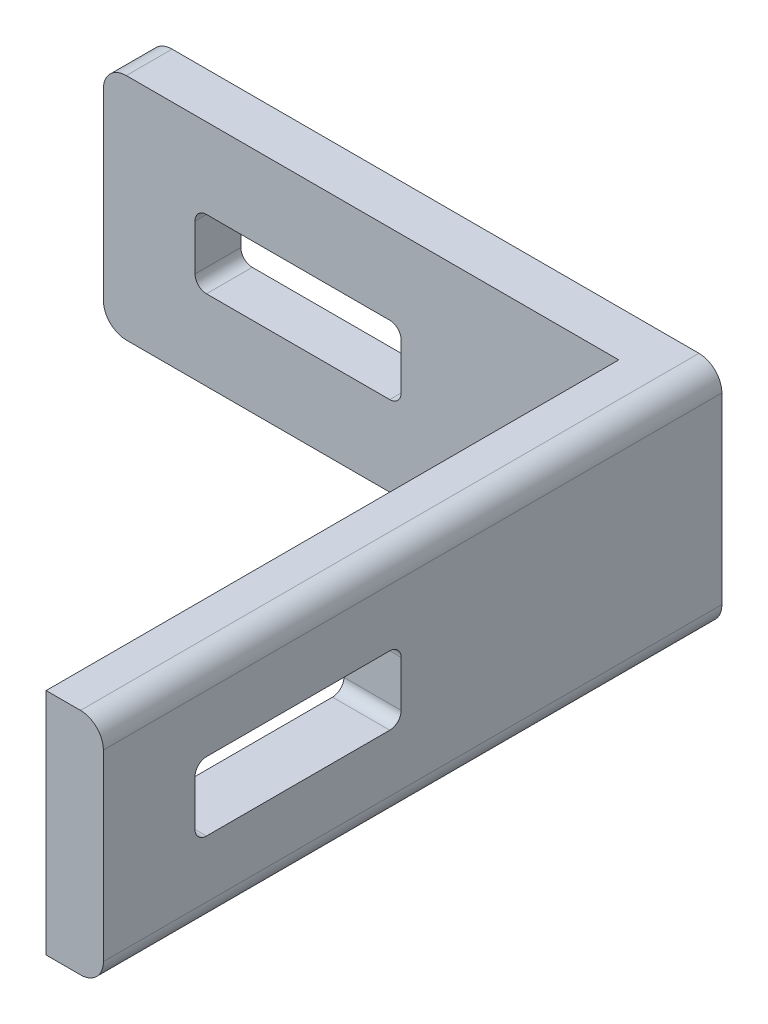
from build123d import *

# Parameters (mm, degrees)
BOSS_EXTRU_1_DEPTH      = 4
BOSS_EXTRU_3_DEPTH      = 50
ENL_V_MAT_EXTRU_1_DEPTH = 50
ENL_V_MAT_EXTRU_2_DEPTH = 50


with BuildPart() as part:
    # Esquisse1 → Boss.-Extru.1 (new body)
    with BuildSketch(Plane.XY):
        with BuildLine():
            Line((-11.273273273, 8.708708709), (34.726726727, 8.708708709))
            ThreePointArc((34.726726727, 8.708708709), (36.140940289, 8.122922271), (36.726726727, 6.708708709))
            Line((36.726726727, 6.708708709), (36.726726727, -9.291291291))
            ThreePointArc((36.726726727, -9.291291291), (36.140940289, -10.705504854), (34.726726727, -11.291291291))
            Line((34.726726727, -11.291291291), (-11.273273273, -11.291291291))
            ThreePointArc((-11.273273273, -11.291291291), (-12.687486836, -10.705504854), (-13.273273273, -9.291291291))
            Line((-13.273273273, -9.291291291), (-13.273273273, 6.708708709))
            ThreePointArc((-13.273273273, 6.708708709), (-12.687486836, 8.122922271), (-11.273273273, 8.708708709))
        make_face()
    extrude(amount=BOSS_EXTRU_1_DEPTH)

    # Esquisse2 → Boss.-Extru.3 (add)
    with BuildSketch(Plane.XY.offset(4)):
        with BuildLine():
            Line((31.726726727, 8.708708709), (34.726726727, 8.708708709))
            ThreePointArc((34.726726727, 8.708708709), (36.140940289, 8.122922271), (36.726726727, 6.708708709))
            Line((36.726726727, 6.708708709), (36.726726727, -9.291291291))
            ThreePointArc((36.726726727, -9.291291291), (36.140940289, -10.705504854), (34.726726727, -11.291291291))
            Line((34.726726727, -11.291291291), (31.726726727, -11.291291291))
            Line((31.726726727, -11.291291291), (31.726726727, 8.708708709))
        make_face()
    extrude(amount=BOSS_EXTRU_3_DEPTH)

    # Esquisse3 → Enlèv. mat.-Extru.1 (cut)
    with BuildSketch(Plane.XY.offset(4)):
        with BuildLine():
            Line((-4.273273273, 1.708708709), (11.726726727, 1.708708709))
            ThreePointArc((11.726726727, 1.708708709), (12.433833508, 1.41581549), (12.726726727, 0.708708709))
            Line((12.726726727, 0.708708709), (12.726726727, -3.291291291))
            ThreePointArc((12.726726727, -3.291291291), (12.433833508, -3.998398072), (11.726726727, -4.291291291))
            Line((11.726726727, -4.291291291), (-4.273273273, -4.291291291))
            ThreePointArc((-4.273273273, -4.291291291), (-4.980380054, -3.998398072), (-5.273273273, -3.291291291))
            Line((-5.273273273, -3.291291291), (-5.273273273, 0.708708709))
            ThreePointArc((-5.273273273, 0.708708709), (-4.980380054, 1.41581549), (-4.273273273, 1.708708709))
        make_face()
    extrude(amount=-ENL_V_MAT_EXTRU_1_DEPTH, mode=Mode.SUBTRACT)

    # Esquisse4 → Enlèv. mat.-Extru.2 (cut)
    with BuildSketch(Plane.ZY.offset(-31.726726727)):
        with BuildLine():
            Line((29, 1.708708709), (45, 1.708708709))
            ThreePointArc((45, 1.708708709), (45.707106781, 1.41581549), (46, 0.708708709))
            Line((46, 0.708708709), (46, -3.291291291))
            ThreePointArc((46, -3.291291291), (45.707106781, -3.998398072), (45, -4.291291291))
            Line((45, -4.291291291), (29, -4.291291291))
            ThreePointArc((29, -4.291291291), (28.292893219, -3.998398072), (28, -3.291291291))
            Line((28, -3.291291291), (28, 0.708708709))
            ThreePointArc((28, 0.708708709), (28.292893219, 1.41581549), (29, 1.708708709))
        make_face()
    extrude(amount=-ENL_V_MAT_EXTRU_2_DEPTH, mode=Mode.SUBTRACT)


solid = part.part
